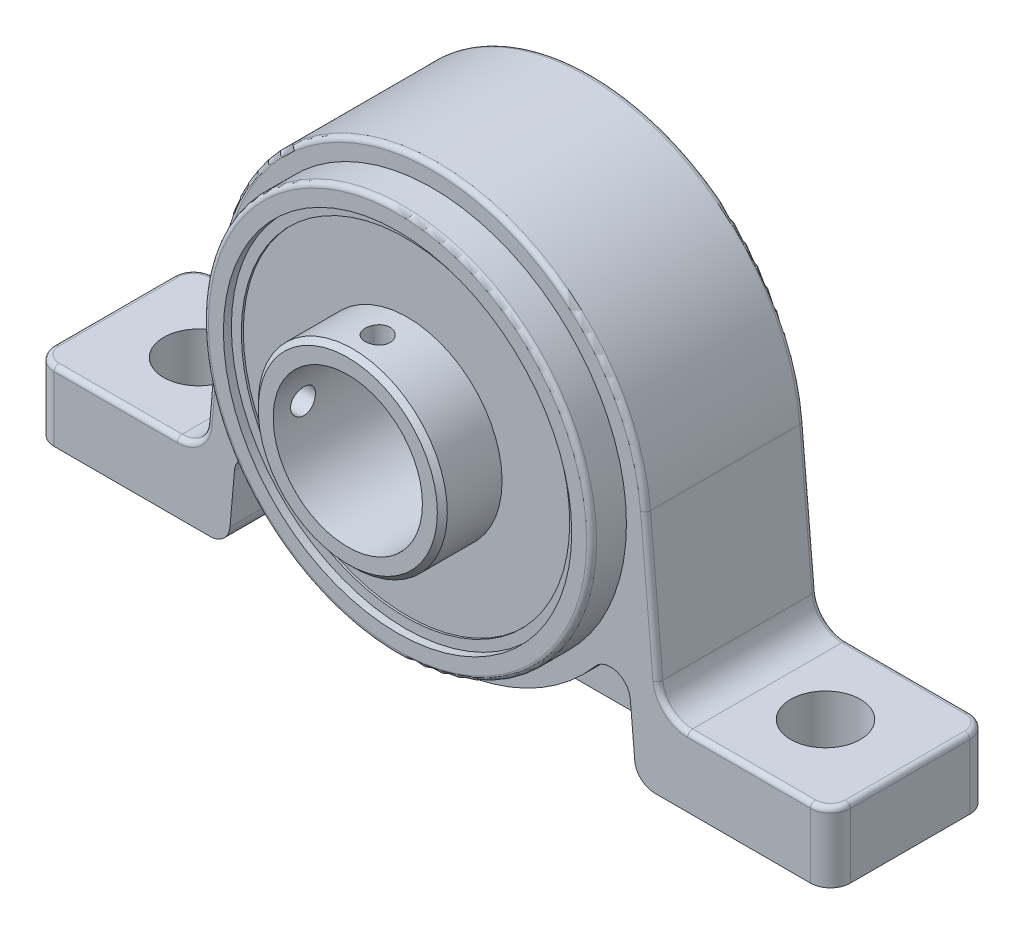
from build123d import *

# Parameters (mm, degrees)
SKETCH1_R           = 19.5
EXTRUDE_B_DEPTH     = 16
B1S_START           = 3
SKETCH1_3_R         = 19.5
SKETCH1_3_R_2       = 17.5
B1S_DEPTH           = 16.5
BOSS_EXTRUDE3_START = 3.2
SKETCH1_4_R         = 17.5
SKETCH1_4_R_2       = 16.5
BOSS_EXTRUDE3_DEPTH = 15.5
BOSS_EXTRUDE4_START = 3.5
SKETCH1_6_R         = 16.5
SKETCH1_6_R_2       = 9.5
BOSS_EXTRUDE4_DEPTH = 15
EXTRUDE_START       = 3
SKETCH1_7_R         = 9.5
SKETCH1_7_R_2       = 7.5
EXTRUDE_A_DEPTH     = 21.5
SKETCH2_W           = 44.65615988
SKETCH2_H           = 5.5
BOSS_EXTRUDE6_DEPTH = 2
CUT_EXTRUDE1_REACH  = 65.973
SKETCH3_R           = 1.25
CIRPATTERN1_COUNT   = 2
CIRPATTERN1_ANGLE   = 90
FILLET1_R           = 2
FILLET2_R           = 0.5
FILLET3_R           = 1
CHAMFER1_SIZE       = 0.5
SKETCH4_R           = 3.5
CUT_EXTRUDE_J_DEPTH = 60.434838438


with BuildPart() as part:
    # Sketch1 → B (new body)
    with BuildSketch(Plane.XY):
        with BuildLine():
            Line((-40, 7), (-40, 0))
            Line((-40, 0), (-22.32807994, 0))
            ThreePointArc((-22.32807994, 0), (-20.976899525, 0.525445326), (-20.335690544, 1.825688515))
            Line((-20.335690544, 1.825688515), (-19.887996435, 6.94285559))
            ThreePointArc((-19.887996435, 6.94285559), (-18.503707136, 8.673856224), (-16.372576653, 8.064838223))
            ThreePointArc((-16.372576653, 8.064838223), (0, 0.5), (16.372576653, 8.064838223))
            ThreePointArc((16.372576653, 8.064838223), (18.503707136, 8.673856224), (19.887996435, 6.94285559))
            Line((19.887996435, 6.94285559), (20.335690544, 1.825688515))
            ThreePointArc((20.335690544, 1.825688515), (20.976899525, 0.525445326), (22.32807994, 0))
            Line((22.32807994, 0), (40, 0))
            Line((40, 0), (40, 7))
            Line((40, 7), (25.643449982, 7))
            ThreePointArc((25.643449982, 7), (23.616679359, 7.78816799), (22.654865888, 9.738532772))
            Line((22.654865888, 9.738532772), (21.418186009, 23.873848469))
            ThreePointArc((21.418186009, 23.873848469), (0, 43.5), (-21.418186009, 23.873848469))
            Line((-21.418186009, 23.873848469), (-22.654865888, 9.738532772))
            ThreePointArc((-22.654865888, 9.738532772), (-23.616679359, 7.78816799), (-25.643449982, 7))
            Line((-25.643449982, 7), (-40, 7))
        make_face()
        with Locations((0, 22)):
            Circle(SKETCH1_R, mode=Mode.SUBTRACT)
    extrude(amount=EXTRUDE_B_DEPTH)

    # Sketch1<3> → B1S (add)
    with BuildSketch(Plane.XY.offset(B1S_START)):
        with Locations((0, 22)):
            Circle(SKETCH1_3_R)
        with Locations((0, 22)):
            Circle(SKETCH1_3_R_2, mode=Mode.SUBTRACT)
    extrude(amount=B1S_DEPTH)

    # Sketch1<4> → Boss-Extrude3 (add)
    with BuildSketch(Plane.XY.offset(BOSS_EXTRUDE3_START)):
        with Locations((0, 22)):
            Circle(SKETCH1_4_R)
        with Locations((0, 22)):
            Circle(SKETCH1_4_R_2, mode=Mode.SUBTRACT)
    extrude(amount=BOSS_EXTRUDE3_DEPTH)

    # Sketch1<6> → Boss-Extrude4 (add)
    with BuildSketch(Plane.XY.offset(BOSS_EXTRUDE4_START)):
        with Locations((0, 22)):
            Circle(SKETCH1_6_R)
        with Locations((0, 22)):
            Circle(SKETCH1_6_R_2, mode=Mode.SUBTRACT)
    extrude(amount=BOSS_EXTRUDE4_DEPTH)

    # Sketch1<7> → A (add)
    with BuildSketch(Plane.XY.offset(EXTRUDE_START)):
        with Locations((0, 22)):
            Circle(SKETCH1_7_R)
        with Locations((0, 22)):
            Circle(SKETCH1_7_R_2, mode=Mode.SUBTRACT)
    extrude(amount=EXTRUDE_A_DEPTH)

    # Sketch2 → Boss-Extrude6 (add, symmetric)
    with BuildSketch(Plane.XY.offset(8)):
        with Locations((0, 2.75)):
            Rectangle(SKETCH2_W, SKETCH2_H)
    extrude(amount=BOSS_EXTRUDE6_DEPTH, both=True)

    # Sketch3 → Cut-Extrude1 (cut, up to next)
    with BuildSketch(Plane(origin=(0, 0, 0), x_dir=(0, 0, -1), z_dir=(1, 0, 0)), mode=Mode.PRIVATE) as cut_extrude1_sk1:
        with Locations((-21.5, 22)):
            Circle(SKETCH3_R)
    cut_extrude1_tool1 = extrude(cut_extrude1_sk1.sketch, amount=-CUT_EXTRUDE1_REACH, mode=Mode.PRIVATE) & part.part
    cut_extrude1 = cut_extrude1_tool1.solids().sort_by_distance((0, 22, 21.5))[0]
    add(cut_extrude1, mode=Mode.SUBTRACT)

    # CirPattern1: Cut-Extrude1 ×2 about axis
    cirpattern1_axis = Axis((0, 22, 24.5), (0, 0, -1))
    for i in range(1, CIRPATTERN1_COUNT):
        add(cut_extrude1.rotate(cirpattern1_axis, i * CIRPATTERN1_ANGLE / (CIRPATTERN1_COUNT - 1)), mode=Mode.SUBTRACT)

    # Fillet1
    fillet1_edges = [part.edges().sort_by_distance(p)[0] for p in [
        (-40, 3.5, 0),
        (-40, 3.5, 16),
        (40, 3.5, 0),
        (40, 3.5, 16),
    ]]
    fillet(fillet1_edges, radius=FILLET1_R)

    # Fillet2
    fillet2_edges = [part.edges().sort_by_distance(p)[0] for p in [
        (22.036525948, 16.80619062, 16),
        (23.616679359, 7.78816799, 16),
        (31.821724991, 7, 16),
        (39.414213562, 7, 15.414213562),
        (40, 7, 8),
        (39.414213562, 7, 0.585786438),
        (31.821724991, 7, 0),
        (23.616679359, 7.78816799, 0),
        (22.036525948, 16.80619062, 0),
        (0, 43.5, 0),
        (-22.036525948, 16.80619062, 0),
        (-23.616679359, 7.78816799, 0),
        (-31.821724991, 7, 0),
        (-39.414213562, 7, 0.585786438),
        (-40, 7, 8),
        (-39.414213562, 7, 15.414213562),
        (-31.821724991, 7, 16),
        (-23.616679359, 7.78816799, 16),
        (-22.036525948, 16.80619062, 16),
        (0, 43.5, 16),
        (-19.5, 22, 19.5),
    ]]
    fillet(fillet2_edges, radius=FILLET2_R)

    # Fillet3
    fillet3_edges = [part.edges().sort_by_distance(p)[0] for p in [
        (-19.5, 22, 0),
    ]]
    fillet(fillet3_edges, radius=FILLET3_R)

    # Chamfer1
    chamfer1_edges = [part.edges().sort_by_distance(p)[0] for p in [
        (-9.5, 22, 24.5),
    ]]
    chamfer(chamfer1_edges, length=CHAMFER1_SIZE)

    # Sketch4 → J (cut, through all)
    with BuildSketch(Plane(origin=(0, 7, 0), x_dir=(1, 0, 0), z_dir=(0, 1, 0))):
        with Locations((31.5, -8)):
            Circle(SKETCH4_R)
        with Locations((-31.5, -8)):
            Circle(SKETCH4_R)
    extrude(amount=-CUT_EXTRUDE_J_DEPTH, mode=Mode.SUBTRACT)


solid = part.part
